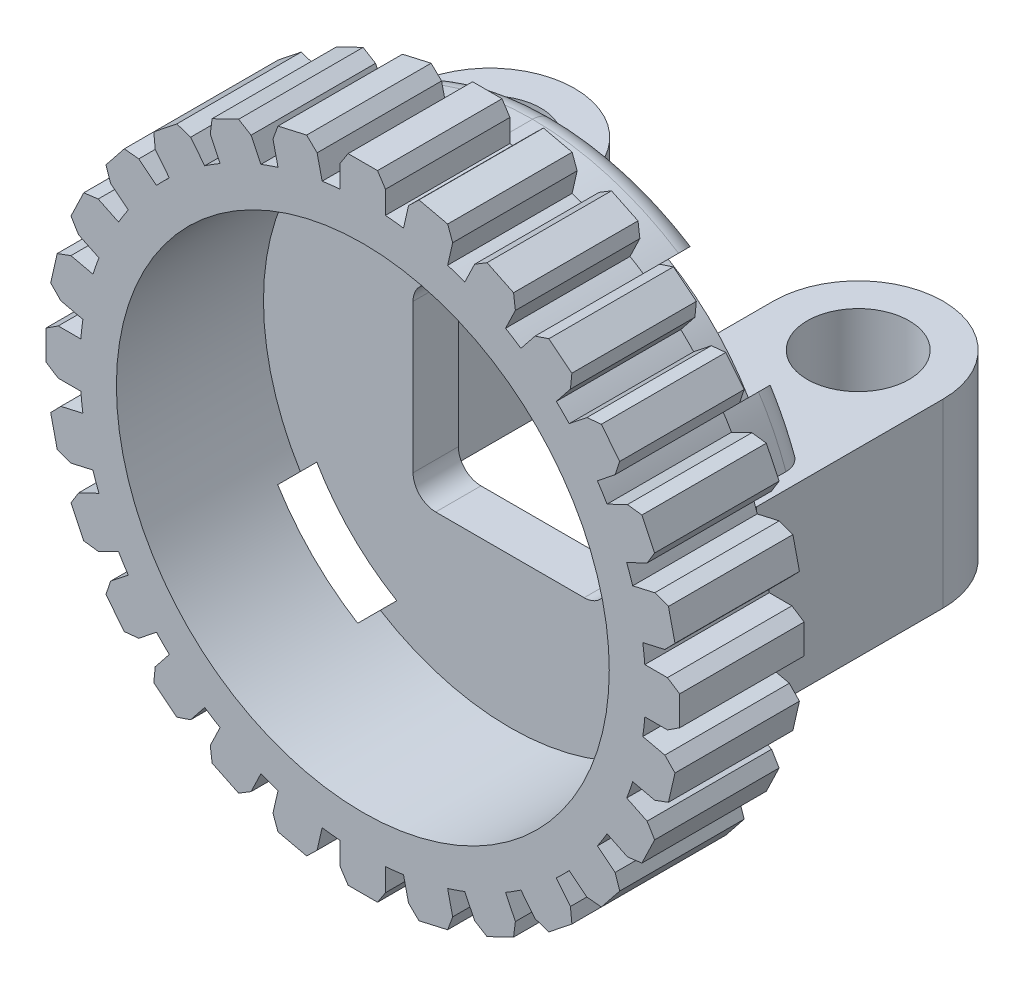
from build123d import *
from build123d.topology import SkipClean

# Parameters (mm, degrees)
SKETCH1_R           = 12.5
SKETCH1_R_2         = 10.89
BOSS_EXTRUDE2_DEPTH = 5.5
BOSS_EXTRUDE3_START = -5.5
BOSS_EXTRUDE3_DEPTH = 5.5
CIRPATTERN1_COUNT   = 28
SKETCH9_R           = 9.5
BOSS_EXTRUDE5_DEPTH = 2
CUT_EXTRUDE1_DEPTH  = 3
CUT_EXTRUDE2_DEPTH  = 3
SKETCH19_R          = 2.25
BOSS_EXTRUDE6_DEPTH = 4
SKETCH20_R          = 10.89
CUT_EXTRUDE3_DEPTH  = 8


with BuildPart() as part:
    # Sketch1 → Boss-Extrude2 (new body)
    with BuildSketch(Plane.XY):
        Circle(SKETCH1_R)
        Circle(SKETCH1_R_2, mode=Mode.SUBTRACT)
    extrude(amount=BOSS_EXTRUDE2_DEPTH)

    # Sketch2 → Boss-Extrude3 (add)
    with BuildSketch(Plane.XY.offset(5.5).offset(BOSS_EXTRUDE3_START)):
        with BuildLine():
            Line((-1, 12.459935794), (-1, 13.459935794))
            Line((-1, 13.459935794), (-0.65, 14))
            Line((-0.65, 14), (0.65, 14))
            Line((0.65, 14), (1, 13.459935794))
            Line((1, 13.459935794), (1, 12.459935794))
            ThreePointArc((1, 12.459935794), (0, 12.5), (-1, 12.459935794))
        make_face()
    boss_extrude3 = extrude(amount=BOSS_EXTRUDE3_DEPTH)

    # CirPattern1: Boss-Extrude3 ×28 about axis
    cirpattern1_axis = Axis((0, 0, 0), (0, 0, 1))
    for i in range(1, CIRPATTERN1_COUNT):
        add(boss_extrude3.rotate(cirpattern1_axis, i * 360 / CIRPATTERN1_COUNT))



with BuildPart() as body_2:
    # Sketch9 → Boss-Extrude5 (new body)
    with BuildSketch(Plane(origin=(0, 0, -3), x_dir=(-1, 0, 0), z_dir=(0, 0, -1))):
        Circle(SKETCH9_R)
    extrude(amount=-BOSS_EXTRUDE5_DEPTH)


with BuildPart() as part_1:
    with SkipClean():  # the faces are left unmerged after this step: merging them gives an invalid solid
        add(part.part)

        add(body_2.part)  # Sweep2 merges body 2
        # Sweep2: sweep along a path in Sketch13
        with BuildLine(Plane(origin=(0, 0, 0), x_dir=(-1, 0, 0), z_dir=(0, 0, -1))) as sweep2_path:
            CenterArc((0, 0), 11.89, 0, 360)
        # Sketch15 → Sweep2 (sweep)
        with BuildSketch(Plane(origin=(0, 0, 0), x_dir=(0, 0, -1), z_dir=(1, 0, 0))):
            with BuildLine():
                Line((0, 11.89), (0, 10.89))
                Line((0, 10.89), (1, 10.89))
                Line((1, 10.89), (1, 9.5))
                Line((1, 9.5), (3, 9.5))
                Line((3, 9.5), (3, 10.89))
                ThreePointArc((3, 10.89), (2.707106781, 11.597106781), (2, 11.89))
                Line((2, 11.89), (0, 11.89))
            make_face()
        sweep(path=sweep2_path.line)

    # Sketch16 → Cut-Extrude1 (cut)
    with SkipClean():  # the faces are left unmerged after this step: merging them gives an invalid solid
        with BuildSketch(Plane(origin=(0, 0, -3), x_dir=(-1, 0, 0), z_dir=(0, 0, -1))):
            with BuildLine():
                Line((-4.998402569, 8.533936475), (-5.726967866, 9.262501771))
                ThreePointArc((-5.726967866, 9.262501771), (-7.700392847, 7.700392847), (-9.262501771, 5.726967866))
                Line((-9.262501771, 5.726967866), (-8.533936475, 4.998402569))
                ThreePointArc((-8.533936475, 4.998402569), (-6.993286066, 6.993286066), (-4.998402569, 8.533936475))
            make_face()
            with BuildLine():
                Line((-5.726967866, 9.262501771), (-6.451785955, 9.987319861))
                ThreePointArc((-6.451785955, 9.987319861), (-8.407499628, 8.407499628), (-9.987319861, 6.451785955))
                Line((-9.987319861, 6.451785955), (-9.262501771, 5.726967866))
                ThreePointArc((-9.262501771, 5.726967866), (-7.700392847, 7.700392847), (-5.726967866, 9.262501771))
            make_face()
            with BuildLine():
                ThreePointArc((9.262501771, 5.726967866), (7.700392847, 7.700392847), (5.726967866, 9.262501771))
                Line((5.726967866, 9.262501771), (4.998402569, 8.533936475))
                ThreePointArc((4.998402569, 8.533936475), (6.993286066, 6.993286066), (8.533936475, 4.998402569))
                Line((8.533936475, 4.998402569), (9.262501771, 5.726967866))
            make_face()
            with BuildLine():
                ThreePointArc((9.987319861, 6.451785955), (8.407499628, 8.407499628), (6.451785955, 9.987319861))
                Line((6.451785955, 9.987319861), (5.726967866, 9.262501771))
                ThreePointArc((5.726967866, 9.262501771), (7.700392847, 7.700392847), (9.262501771, 5.726967866))
                Line((9.262501771, 5.726967866), (9.987319861, 6.451785955))
            make_face()
            with BuildLine():
                ThreePointArc((6.451785955, -9.987319861), (8.407499628, -8.407499628), (9.987319861, -6.451785955))
                Line((9.987319861, -6.451785955), (9.262501771, -5.726967866))
                ThreePointArc((9.262501771, -5.726967866), (7.700392847, -7.700392847), (5.726967866, -9.262501771))
                Line((5.726967866, -9.262501771), (6.451785955, -9.987319861))
            make_face()
            with BuildLine():
                ThreePointArc((5.726967866, -9.262501771), (7.700392847, -7.700392847), (9.262501771, -5.726967866))
                Line((9.262501771, -5.726967866), (8.533936475, -4.998402569))
                ThreePointArc((8.533936475, -4.998402569), (6.993286066, -6.993286066), (4.998402569, -8.533936475))
                Line((4.998402569, -8.533936475), (5.726967866, -9.262501771))
            make_face()
            with BuildLine():
                Line((-8.533936475, -4.998402569), (-9.262501771, -5.726967866))
                ThreePointArc((-9.262501771, -5.726967866), (-7.700392847, -7.700392847), (-5.726967866, -9.262501771))
                Line((-5.726967866, -9.262501771), (-4.998402569, -8.533936475))
                ThreePointArc((-4.998402569, -8.533936475), (-6.993286066, -6.993286066), (-8.533936475, -4.998402569))
            make_face()
            with BuildLine():
                Line((-9.262501771, -5.726967866), (-9.987319861, -6.451785955))
                ThreePointArc((-9.987319861, -6.451785955), (-8.407499628, -8.407499628), (-6.451785955, -9.987319861))
                Line((-6.451785955, -9.987319861), (-5.726967866, -9.262501771))
                ThreePointArc((-5.726967866, -9.262501771), (-7.700392847, -7.700392847), (-9.262501771, -5.726967866))
            make_face()
        extrude(amount=-CUT_EXTRUDE1_DEPTH, mode=Mode.SUBTRACT)

    # Sketch17 → Cut-Extrude2 (cut)
    with SkipClean():  # the faces are left unmerged after this step: merging them gives an invalid solid
        with BuildSketch(Plane(origin=(0, 0, -3), x_dir=(-1, 0, 0), z_dir=(0, 0, -1))):
            with BuildLine():
                Line((-3.28, -4.28), (3.28, -4.28))
                ThreePointArc((3.28, -4.28), (3.987106781, -3.987106781), (4.28, -3.28))
                Line((4.28, -3.28), (4.28, 3.28))
                ThreePointArc((4.28, 3.28), (3.987106781, 3.987106781), (3.28, 4.28))
                Line((3.28, 4.28), (-3.28, 4.28))
                ThreePointArc((-3.28, 4.28), (-3.987106781, 3.987106781), (-4.28, 3.28))
                Line((-4.28, 3.28), (-4.28, -3.28))
                ThreePointArc((-4.28, -3.28), (-3.987106781, -3.987106781), (-3.28, -4.28))
            make_face()
        extrude(amount=-CUT_EXTRUDE2_DEPTH, mode=Mode.SUBTRACT)

    # Sketch19 → Boss-Extrude6 (add, symmetric)
    with BuildSketch(Plane(origin=(0, 0, 0), x_dir=(1, 0, 0), z_dir=(0, 1, 0))):
        with BuildLine():
            Line((-11.89, 0), (-11.89, 8.25))
            ThreePointArc((-11.89, 8.25), (-8.14, 12), (-4.39, 8.25))
            Line((-4.39, 8.25), (-4.39, 0))
            Line((-4.39, 0), (-11.89, 0))
        make_face()
        with Locations(Location((-8.14, 8.25, 0), (0, 0, 270))):
            Circle(SKETCH19_R, mode=Mode.SUBTRACT)
    boss_extrude6 = extrude(amount=BOSS_EXTRUDE6_DEPTH, both=True)

    # Mirror1: Boss-Extrude6 across plane
    add(boss_extrude6.mirror(Plane(origin=(0, 0, 0), x_dir=(0, 0, 1), z_dir=(1, 0, 0))))

    # Sketch20 → Cut-Extrude3 (cut)
    with BuildSketch(Plane.XY.offset(-1)):
        with Locations(Location((0, 0, 0), (0, 0, 148.271663661))):
            Circle(SKETCH20_R)
    extrude(amount=CUT_EXTRUDE3_DEPTH, mode=Mode.SUBTRACT)


solid = part_1.part
